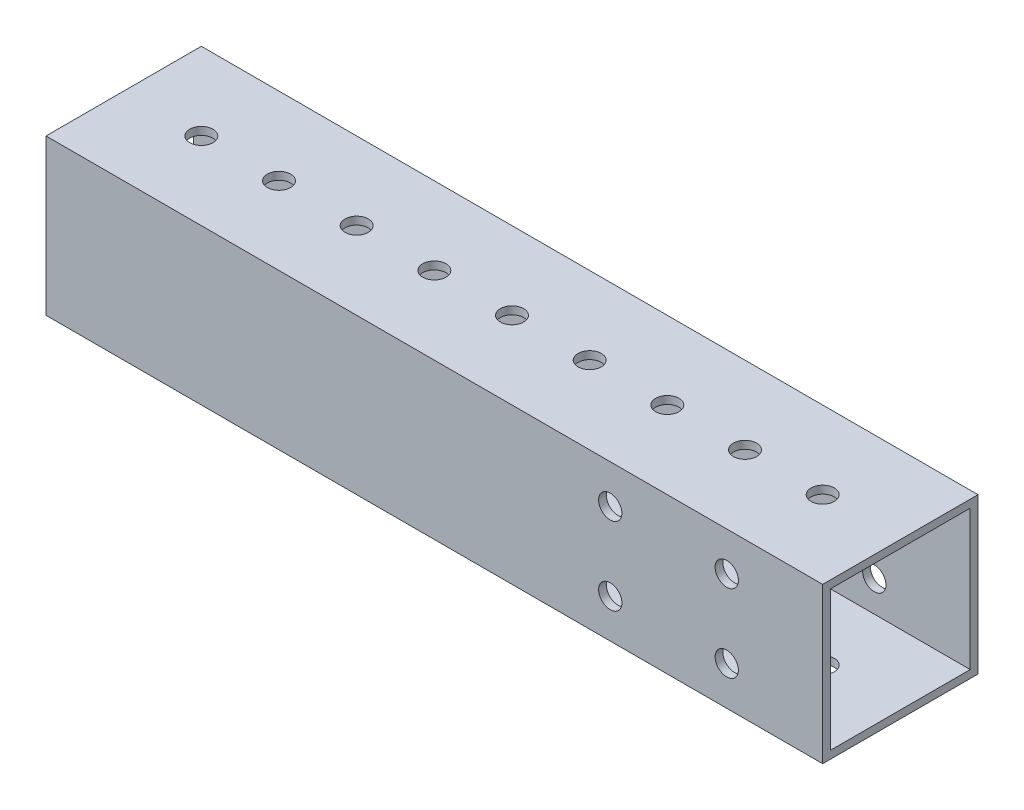
from build123d import *

# Parameters (mm, degrees)
SKETCH_1_W          = 20
SKETCH_1_H          = 20
SKETCH_1_W_2        = 18
SKETCH_1_H_2        = 18
EXTRUDE_1_DEPTH     = 100
SKETCH_2_R          = 1.5
CUT_EXTRUDE_1_DEPTH = 104.923048454
SKETCH_3_R          = 1.5
CUT_EXTRUDE_2_DEPTH = 104.923048454


with BuildPart() as part:
    # 草图1 → 凸台-拉伸1 (new body)
    with BuildSketch(Plane(origin=(0, 0, 0), x_dir=(0, 0, -1), z_dir=(1, 0, 0))):
        with Locations((-10, 10)):
            Rectangle(SKETCH_1_W, SKETCH_1_H)
        with Locations((-10, 10)):
            Rectangle(SKETCH_1_W_2, SKETCH_1_H_2, mode=Mode.SUBTRACT)
    extrude(amount=EXTRUDE_1_DEPTH)

    # 草图2 → 切除-拉伸1 (cut, through all)
    with BuildSketch(Plane.XY.offset(20)):
        with Locations((72.65, 15)):
            Circle(SKETCH_2_R)
        with Locations(Location((72.65, 5, 0), (0, 0, 180))):
            Circle(SKETCH_2_R)
        with Locations((87.65, 15)):
            Circle(SKETCH_2_R)
        with Locations(Location((87.65, 5, 0), (0, 0, 180))):
            Circle(SKETCH_2_R)
    extrude(amount=-CUT_EXTRUDE_1_DEPTH, mode=Mode.SUBTRACT)

    # 草图3 → 切除-拉伸2 (cut, through all)
    with BuildSketch(Plane(origin=(0, 20, 0), x_dir=(1, 0, 0), z_dir=(0, 1, 0))):
        with Locations(Location((90, -10, 0), (0, 0, 270))):
            Circle(SKETCH_3_R)
        with Locations(Location((80, -10, 0), (0, 0, 270))):
            Circle(SKETCH_3_R)
        with Locations(Location((70, -10, 0), (0, 0, 270))):
            Circle(SKETCH_3_R)
        with Locations(Location((60, -10, 0), (0, 0, 270))):
            Circle(SKETCH_3_R)
        with Locations(Location((50, -10, 0), (0, 0, 270))):
            Circle(SKETCH_3_R)
        with Locations(Location((40, -10, 0), (0, 0, 270))):
            Circle(SKETCH_3_R)
        with Locations(Location((30, -10, 0), (0, 0, 270))):
            Circle(SKETCH_3_R)
        with Locations(Location((20, -10, 0), (0, 0, 270))):
            Circle(SKETCH_3_R)
        with Locations(Location((10, -10, 0), (0, 0, 270))):
            Circle(SKETCH_3_R)
    extrude(amount=-CUT_EXTRUDE_2_DEPTH, mode=Mode.SUBTRACT)


solid = part.part
